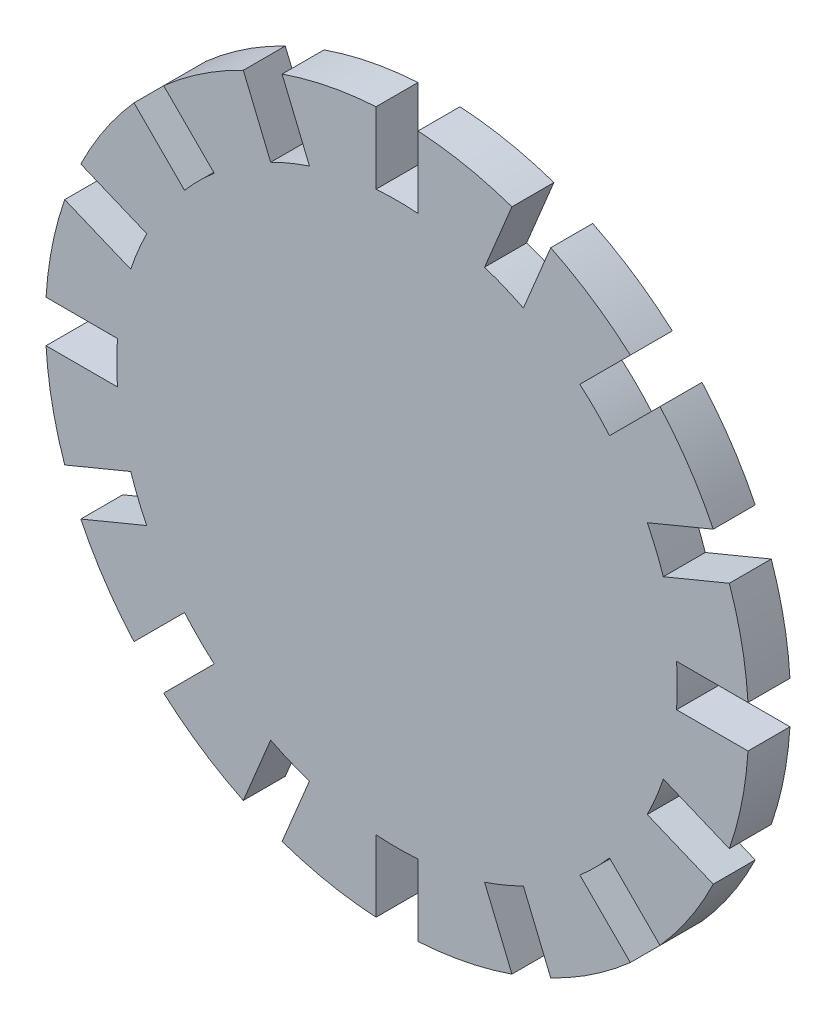
from build123d import *

# Parameters (mm, degrees)
BOSS_EXTRUDE1_DEPTH = 1.6446


with BuildPart() as part:
    # Sketch1 → Boss-Extrude1 (new body)
    with BuildSketch(Plane.XY):
        with BuildLine():
            ThreePointArc((-3.43261036, 10.436873188), (-4.204490048, 10.150536896), (-4.952761743, 9.807205869))
            Line((-4.952761743, 9.807205869), (-6.024377274, 12.394314617))
            ThreePointArc((-6.024377274, 12.394314617), (-7.65623669, 11.458367951), (-9.145424221, 10.308897719))
            Line((-9.145424221, 10.308897719), (-7.16533691, 8.328810408))
            ThreePointArc((-7.16533691, 8.328810408), (-7.768884599, 7.768884599), (-8.328810408, 7.16533691))
            Line((-8.328810408, 7.16533691), (-10.308897719, 9.145424221))
            ThreePointArc((-10.308897719, 9.145424221), (-11.458367951, 7.65623669), (-12.394314617, 6.024377274))
            Line((-12.394314617, 6.024377274), (-9.807205869, 4.952761743))
            ThreePointArc((-9.807205869, 4.952761743), (-10.150536896, 4.204490048), (-10.436873188, 3.43261036))
            Line((-10.436873188, 3.43261036), (-13.023981937, 4.504225891))
            ThreePointArc((-13.023981937, 4.504225891), (-13.516066562, 2.688512797), (-13.756282967, 0.8227))
            Line((-13.756282967, 0.8227), (-10.956016637, 0.8227))
            ThreePointArc((-10.956016637, 0.8227), (-10.986861965, 0), (-10.956016637, -0.8227))
            Line((-10.956016637, -0.8227), (-13.756282967, -0.8227))
            ThreePointArc((-13.756282967, -0.8227), (-13.516066562, -2.688512797), (-13.023981937, -4.504225891))
            Line((-13.023981937, -4.504225891), (-10.436873188, -3.43261036))
            ThreePointArc((-10.436873188, -3.43261036), (-10.150536896, -4.204490048), (-9.807205869, -4.952761743))
            Line((-9.807205869, -4.952761743), (-12.394314617, -6.024377274))
            ThreePointArc((-12.394314617, -6.024377274), (-11.458367951, -7.65623669), (-10.308897719, -9.145424221))
            Line((-10.308897719, -9.145424221), (-8.328810408, -7.16533691))
            ThreePointArc((-8.328810408, -7.16533691), (-7.768884599, -7.768884599), (-7.16533691, -8.328810408))
            Line((-7.16533691, -8.328810408), (-9.145424221, -10.308897719))
            ThreePointArc((-9.145424221, -10.308897719), (-7.65623669, -11.458367951), (-6.024377274, -12.394314617))
            Line((-6.024377274, -12.394314617), (-4.952761743, -9.807205869))
            ThreePointArc((-4.952761743, -9.807205869), (-4.204490048, -10.150536896), (-3.43261036, -10.436873188))
            Line((-3.43261036, -10.436873188), (-4.504225891, -13.023981937))
            ThreePointArc((-4.504225891, -13.023981937), (-2.688512797, -13.516066562), (-0.8227, -13.756282967))
            Line((-0.8227, -13.756282967), (-0.8227, -10.956016637))
            ThreePointArc((-0.8227, -10.956016637), (0, -10.986861965), (0.8227, -10.956016637))
            Line((0.8227, -10.956016637), (0.8227, -13.756282967))
            ThreePointArc((0.8227, -13.756282967), (2.688512797, -13.516066562), (4.504225891, -13.023981937))
            Line((4.504225891, -13.023981937), (3.43261036, -10.436873188))
            ThreePointArc((3.43261036, -10.436873188), (4.204490048, -10.150536896), (4.952761743, -9.807205869))
            Line((4.952761743, -9.807205869), (6.024377274, -12.394314617))
            ThreePointArc((6.024377274, -12.394314617), (7.65623669, -11.458367951), (9.145424221, -10.308897719))
            Line((9.145424221, -10.308897719), (7.16533691, -8.328810408))
            ThreePointArc((7.16533691, -8.328810408), (7.768884599, -7.768884599), (8.328810408, -7.16533691))
            Line((8.328810408, -7.16533691), (10.308897719, -9.145424221))
            ThreePointArc((10.308897719, -9.145424221), (11.458367951, -7.65623669), (12.394314617, -6.024377274))
            Line((12.394314617, -6.024377274), (9.807205869, -4.952761743))
            ThreePointArc((9.807205869, -4.952761743), (10.150536896, -4.204490048), (10.436873188, -3.43261036))
            Line((10.436873188, -3.43261036), (13.023981937, -4.504225891))
            ThreePointArc((13.023981937, -4.504225891), (13.516066562, -2.688512797), (13.756282967, -0.8227))
            Line((13.756282967, -0.8227), (10.956016637, -0.8227))
            ThreePointArc((10.956016637, -0.8227), (10.986861965, 0), (10.956016637, 0.8227))
            Line((10.956016637, 0.8227), (13.756282967, 0.8227))
            ThreePointArc((13.756282967, 0.8227), (13.516066562, 2.688512797), (13.023981937, 4.504225891))
            Line((13.023981937, 4.504225891), (10.436873188, 3.43261036))
            ThreePointArc((10.436873188, 3.43261036), (10.150536896, 4.204490048), (9.807205869, 4.952761743))
            Line((9.807205869, 4.952761743), (12.394314617, 6.024377274))
            ThreePointArc((12.394314617, 6.024377274), (11.458367951, 7.65623669), (10.308897719, 9.145424221))
            Line((10.308897719, 9.145424221), (8.328810408, 7.16533691))
            ThreePointArc((8.328810408, 7.16533691), (7.768884599, 7.768884599), (7.16533691, 8.328810408))
            Line((7.16533691, 8.328810408), (9.145424221, 10.308897719))
            ThreePointArc((9.145424221, 10.308897719), (7.65623669, 11.458367951), (6.024377274, 12.394314617))
            Line((6.024377274, 12.394314617), (4.952761743, 9.807205869))
            ThreePointArc((4.952761743, 9.807205869), (4.204490048, 10.150536896), (3.43261036, 10.436873188))
            Line((3.43261036, 10.436873188), (4.504225891, 13.023981937))
            ThreePointArc((4.504225891, 13.023981937), (2.688512797, 13.516066562), (0.8227, 13.756282967))
            Line((0.8227, 13.756282967), (0.8227, 10.956016637))
            ThreePointArc((0.8227, 10.956016637), (0, 10.986861965), (-0.8227, 10.956016637))
            Line((-0.8227, 10.956016637), (-0.8227, 13.756282967))
            ThreePointArc((-0.8227, 13.756282967), (-2.688512797, 13.516066562), (-4.504225891, 13.023981937))
            Line((-4.504225891, 13.023981937), (-3.43261036, 10.436873188))
        make_face()
    extrude(amount=BOSS_EXTRUDE1_DEPTH)


solid = part.part
